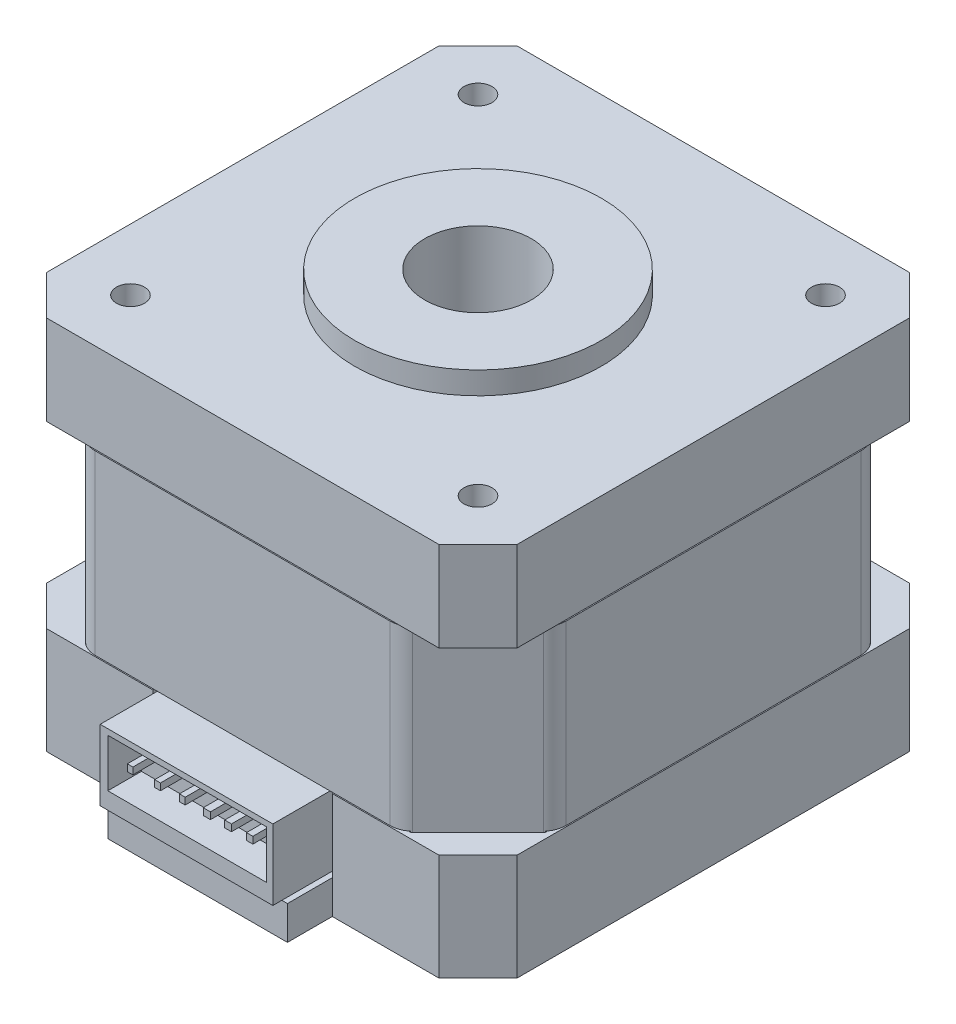
from build123d import *

# Parameters (mm, degrees)
SKETCH_1_R             = 0.5
EXTRUDE_1_DEPTH        = 8
EXTRUDE_2_DEPTH        = 16
EXTRUDE_3_DEPTH        = 9.5
SKETCH_5_W             = 57.653933414
SKETCH_5_H             = 56.367180184
SKETCH_5_W_2           = 41
SKETCH_5_H_2           = 41
CUT_EXTRUDE_1_DEPTH    = 0.1
SKETCH_6_W             = 58.986763218
SKETCH_6_H             = 56.93915862
SKETCH_6_W_2           = 41
SKETCH_6_H_2           = 41
CUT_EXTRUDE_2_DEPTH    = 0.1
SKETCH_7_R             = 3
CUT_EXTRUDE_3_DEPTH    = 3
HOLE_WIZARD_M3_1_D     = 2.5
HOLE_WIZARD_M3_1_DEPTH = 5
HOLE_WIZARD_M3_1_TIP   = 0.751075774
SKETCH_10_R            = 11
EXTRUDE_4_DEPTH        = 2
SKETCH_11_R            = 4.75
CUT_EXTRUDE_4_DEPTH    = 69
SKETCH_12_R            = 5
CUT_EXTRUDE_5_DEPTH    = 3
CUT_EXTRUDE_6_DEPTH    = 0.1
SKETCH_14_W            = 16
SKETCH_14_H            = 4
EXTRUDE_5_DEPTH        = 3
SKETCH_15_W            = 16
SKETCH_15_H            = 6.5
CUT_EXTRUDE_7_DEPTH    = 1
SKETCH_16_W            = 15.4
SKETCH_16_H            = 6.3
EXTRUDE_6_DEPTH        = 6
SKETCH_17_W            = 14.170279092
SKETCH_17_H            = 4.295136409
SKETCH_17_W_2          = 0.495592662
SKETCH_17_H_2          = 0.605724366
SKETCH_17_W_3          = 0.513947946
SKETCH_17_W_4          = 0.513947947
SKETCH_17_W_5          = 0.642434933
SKETCH_17_W_6          = 0.605724365
SKETCH_17_W_7          = 0.569013798
CUT_EXTRUDE_8_DEPTH    = 3


with BuildPart() as part:
    # 草图1 → 凸台-拉伸1 (new body)
    with BuildSketch(Plane(origin=(0, 0, 0), x_dir=(1, 0, 0), z_dir=(0, 1, 0))):
        Polygon((-21, 17.5), (-17.5, 21), (17.5, 21), (21, 17.5), (21, -17.5), (17.5, -21), (-17.5, -21), (-21, -17.5), align=None)
        with Locations(Location((-15.5, 15.5, 0), (0, 0, 270))):
            Circle(SKETCH_1_R, mode=Mode.SUBTRACT)
        with Locations(Location((15.5, 15.5, 0), (0, 0, 270))):
            Circle(SKETCH_1_R, mode=Mode.SUBTRACT)
        with Locations(Location((15.5, -15.5, 0), (0, 0, 270))):
            Circle(SKETCH_1_R, mode=Mode.SUBTRACT)
        with Locations(Location((-15.5, -15.5, 0), (0, 0, 270))):
            Circle(SKETCH_1_R, mode=Mode.SUBTRACT)
    extrude(amount=EXTRUDE_1_DEPTH)

    # 草图2 → 凸台-拉伸2 (add)
    with BuildSketch(Plane.XZ):
        with BuildLine():
            Line((-20.414213562, 14.585786438), (-14.585786438, 20.414213562))
            ThreePointArc((-14.585786438, 20.414213562), (-13.93693974, 20.847759065), (-13.171572875, 21))
            Line((-13.171572875, 21), (13.171572875, 21))
            ThreePointArc((13.171572875, 21), (13.93693974, 20.847759065), (14.585786438, 20.414213562))
            Line((14.585786438, 20.414213562), (20.414213562, 14.585786438))
            ThreePointArc((20.414213562, 14.585786438), (20.847759065, 13.93693974), (21, 13.171572875))
            Line((21, 13.171572875), (21, -13.171572875))
            ThreePointArc((21, -13.171572875), (20.847759065, -13.93693974), (20.414213562, -14.585786438))
            Line((20.414213562, -14.585786438), (14.585786438, -20.414213562))
            ThreePointArc((14.585786438, -20.414213562), (13.93693974, -20.847759065), (13.171572875, -21))
            Line((13.171572875, -21), (-13.171572875, -21))
            ThreePointArc((-13.171572875, -21), (-13.93693974, -20.847759065), (-14.585786438, -20.414213562))
            Line((-14.585786438, -20.414213562), (-20.414213562, -14.585786438))
            ThreePointArc((-20.414213562, -14.585786438), (-20.847759065, -13.93693974), (-21, -13.171572875))
            Line((-21, -13.171572875), (-21, 13.171572875))
            ThreePointArc((-21, 13.171572875), (-20.847759065, 13.93693974), (-20.414213562, 14.585786438))
        make_face()
    extrude(amount=EXTRUDE_2_DEPTH)

    # 草图3 → 凸台-拉伸3 (add)
    with BuildSketch(Plane.XZ.offset(16)):
        Polygon((-21, 17.5), (-17.5, 21), (17.5, 21), (21, 17.5), (21, -17.5), (17.5, -21), (-17.5, -21), (-21, -17.5), align=None)
    extrude(amount=EXTRUDE_3_DEPTH)

    # 草图5 → 切除-拉伸1 (cut)
    with BuildSketch(Plane.XZ):
        Rectangle(SKETCH_5_W, SKETCH_5_H)
        Rectangle(SKETCH_5_W_2, SKETCH_5_H_2, mode=Mode.SUBTRACT)
    extrude(amount=CUT_EXTRUDE_1_DEPTH, mode=Mode.SUBTRACT)

    # 草图6 → 切除-拉伸2 (cut)
    with BuildSketch(Plane(origin=(0, -16, 0), x_dir=(1, 0, 0), z_dir=(0, 1, 0))):
        Rectangle(SKETCH_6_W, SKETCH_6_H)
        Rectangle(SKETCH_6_W_2, SKETCH_6_H_2, mode=Mode.SUBTRACT)
    extrude(amount=CUT_EXTRUDE_2_DEPTH, mode=Mode.SUBTRACT)

    # 草图7 → 切除-拉伸3 (cut)
    with BuildSketch(Plane.XZ.offset(25.5)):
        with Locations(Location((-15.5, 15.5, 0), (0, 0, 270))):
            Circle(SKETCH_7_R)
        with Locations(Location((15.5, 15.5, 0), (0, 0, 270))):
            Circle(SKETCH_7_R)
        with Locations(Location((-15.5, -15.5, 0), (0, 0, 270))):
            Circle(SKETCH_7_R)
        with Locations(Location((15.5, -15.5, 0), (0, 0, 270))):
            Circle(SKETCH_7_R)
    extrude(amount=-CUT_EXTRUDE_3_DEPTH, mode=Mode.SUBTRACT)

    # M3 螺纹孔的螺纹孔钻头1
    with Locations(Plane(origin=(0, 8, 0), x_dir=(1, 0, 0), z_dir=(0, 1, 0))):
        with Locations((-15.5, 15.5), (15.5, 15.5), (-15.5, -15.5), (15.5, -15.5)):
            Hole(HOLE_WIZARD_M3_1_D / 2, depth=HOLE_WIZARD_M3_1_DEPTH)
            with Locations((0, 0, -(HOLE_WIZARD_M3_1_DEPTH + HOLE_WIZARD_M3_1_TIP / 2))):  # 118° drill point
                Cone(0, HOLE_WIZARD_M3_1_D / 2, HOLE_WIZARD_M3_1_TIP, mode=Mode.SUBTRACT)

    # 草图10 → 凸台-拉伸4 (add)
    with BuildSketch(Plane(origin=(0, 8, 0), x_dir=(1, 0, 0), z_dir=(0, 1, 0))):
        with Locations(Location((0, 0, 0), (0, 0, 90))):
            Circle(SKETCH_10_R)
    extrude(amount=EXTRUDE_4_DEPTH)

    # 草图11 → 切除-拉伸4 (cut)
    with BuildSketch(Plane(origin=(0, 10, 0), x_dir=(1, 0, 0), z_dir=(0, 1, 0))):
        with Locations(Location((0, 0, 0), (0, 0, 270))):
            Circle(SKETCH_11_R)
    extrude(amount=-CUT_EXTRUDE_4_DEPTH, mode=Mode.SUBTRACT)

    # 草图12 → 切除-拉伸5 (cut)
    with BuildSketch(Plane.XZ.offset(25.5)):
        with Locations(Location((0, 0, 0), (0, 0, 270))):
            Circle(SKETCH_12_R)
    extrude(amount=-CUT_EXTRUDE_5_DEPTH, mode=Mode.SUBTRACT)

    # 草图13 → 切除-拉伸6 (cut)
    # profile 1 of 8: a face of its own
    with BuildSketch(Plane.XZ.offset(25.5)):
        with BuildLine():
            Line((-7.893407465, 13.891280791), (-7.838218886, 13.891280791))
            Line((-7.838218886, 13.891280791), (-7.843439427, 11.217617889))
            add(Edge.make_bspline(
                [(-7.843439427, 11.217617889), (-7.844034145, 11.1935056), (-7.84517445, 11.14727297), (-7.845266995, 11.081126066), (-7.847442407, 11.021236179), (-7.847615678, 10.967517565), (-7.84923328, 10.920040401), (-7.851103879, 10.878794752), (-7.851281622, 10.843703303), (-7.854590379, 10.788780657), (-7.858533201, 10.713266114), (-7.868311197, 10.635487418), (-7.876095217, 10.580066843), (-7.884008314, 10.554838428), (-7.894033397, 10.53487688), (-7.90403841, 10.537204765), (-7.908323297, 10.538201737)],
                knots=[0, 0, 0, 0, 1.45038606, 2.780953852, 3.977268029, 5.053718292, 6.010937745, 6.833690271, 7.536464333, 8.120251454, 10.142880859, 12.069479857, 12.873132744, 13.440417135, 13.76034519, 14, 14, 14, 14], degree=3))
            add(Edge.make_bspline(
                [(-7.908323297, 10.538201737), (-7.909313826, 10.5389515), (-7.913553533, 10.542160668), (-7.92366406, 10.548953295), (-7.935677452, 10.567161334), (-7.940936163, 10.583496392), (-7.944121294, 10.593390316)],
                knots=[0, 0, 0, 0, 0.221265066, 0.947068446, 2.150880552, 4, 4, 4, 4], degree=3))
            Line((-7.944121294, 10.593390316), (-7.968732417, 10.659019977))
            Line((-7.968732417, 10.659019977), (-8.024666787, 10.840247337))
            add(Edge.make_bspline(
                [(-8.024666787, 10.840247337), (-8.031400079, 10.857298964), (-8.043129126, 10.887002019), (-8.054961145, 10.926080513), (-8.063937314, 10.951033782), (-8.066323107, 10.971259492), (-8.05483073, 10.990231261), (-8.046366988, 11.019442001), (-8.033343551, 11.056727589), (-8.021044965, 11.100734686), (-8.010182413, 11.148283659), (-8.000397149, 11.19965883), (-7.994851558, 11.257541563), (-7.99213123, 11.312807422), (-7.99004354, 11.366016856), (-7.989664239, 11.41724272), (-7.988618076, 11.477895709), (-7.988781507, 11.521651593), (-7.98886879, 11.545020403)],
                knots=[0, 0, 0, 0, 1.220359697, 2.125803599, 2.712350858, 2.994193817, 3.439826662, 4.12562012, 5.031064022, 6.063176816, 7.167225426, 8.277459231, 9.542238136, 11.034069985, 11.961482632, 13.08703073, 14.444263491, 16, 16, 16, 16], degree=3))
            Line((-7.98886879, 11.545020403), (-7.984394041, 13.518384989))
            Line((-7.984394041, 13.518384989), (-8.246166894, 13.291664341))
            Line((-8.246166894, 13.291664341), (-8.266303267, 13.377430376))
            add(Edge.make_bspline(
                [(-8.266303267, 13.377430376), (-8.245024828, 13.399417495), (-8.205137517, 13.440633256), (-8.151830389, 13.499976546), (-8.10798714, 13.551477121), (-8.062321472, 13.611683706), (-8.011193546, 13.686610427), (-7.973437187, 13.748168407), (-7.953816585, 13.780157842)],
                knots=[0, 0, 0, 0, 1.077185482, 2.019228619, 2.808185376, 3.45765616, 4.678836699, 6, 6, 6, 6], degree=3))
            Line((-7.953816585, 13.780157842), (-7.893407465, 13.891280791))
        make_face()
    # profile 2 of 8: a face of its own
    with BuildSketch(Plane.XZ.offset(25.5)):
        with BuildLine():
            add(Edge.make_bspline(
                [(-5.586674032, 13.593709941), (-5.622222861, 13.594235683), (-5.690335163, 13.595243014), (-5.787539006, 13.596231812), (-5.875297591, 13.595492561), (-5.953107037, 13.597273068), (-6.021219903, 13.59561878), (-6.079643364, 13.596152064), (-6.1283835, 13.595520536), (-6.157703617, 13.594263904), (-6.170628858, 13.593709941)],
                knots=[0, 0, 0, 0, 1.461051911, 2.799406174, 3.994695385, 5.067439477, 5.997164994, 6.794024468, 7.468367567, 8, 8, 8, 8], degree=3))
            Line((-6.170628858, 13.593709941), (-6.412265338, 13.58401465))
            add(Edge.make_bspline(
                [(-6.412265338, 13.58401465), (-6.430031076, 13.584155265), (-6.460595666, 13.584397182), (-6.490136123, 13.576768191), (-6.502506122, 13.573573568)],
                knots=[0, 0, 0, 0, 1.16250452, 2, 2, 2, 2], degree=3))
            Line((-6.502506122, 13.573573568), (-6.553219952, 13.553437194))
            add(Edge.make_bspline(
                [(-6.553219952, 13.553437194), (-6.558948955, 13.552190365), (-6.568941751, 13.550015587), (-6.578831705, 13.552413876), (-6.583051616, 13.553437194)],
                knots=[0, 0, 0, 0, 1.146626707, 2, 2, 2, 2], degree=3))
            add(Edge.make_bspline(
                [(-6.583051616, 13.553437194), (-6.58715783, 13.555496577), (-6.597750757, 13.560809228), (-6.612740593, 13.577372046), (-6.633028109, 13.599865979), (-6.646413539, 13.618874117), (-6.653901818, 13.629507938)],
                knots=[0, 0, 0, 0, 0.522008364, 1.346640983, 2.515617707, 4, 4, 4, 4], degree=3))
            Line((-6.653901818, 13.629507938), (-6.759058434, 13.750326178))
            add(Edge.make_bspline(
                [(-6.759058434, 13.750326178), (-6.763048951, 13.755761193), (-6.769156806, 13.764079988), (-6.776618082, 13.776860012), (-6.770212103, 13.787019988), (-6.763389042, 13.789209339), (-6.759058434, 13.790598925)],
                knots=[0, 0, 0, 0, 1.576958087, 2.413680609, 2.993160347, 4, 4, 4, 4], degree=3))
            Line((-6.759058434, 13.790598925), (-6.658376568, 13.780157842))
            Line((-6.658376568, 13.780157842), (-6.482369749, 13.770462551))
            add(Edge.make_bspline(
                [(-6.482369749, 13.770462551), (-6.440866976, 13.767495821), (-6.362137123, 13.761867999), (-6.249977765, 13.757428952), (-6.150458244, 13.756085554), (-6.088338309, 13.758773762), (-6.059505909, 13.760021469)],
                knots=[0, 0, 0, 0, 1.17952993, 2.237542501, 3.181971475, 4, 4, 4, 4], degree=3))
            Line((-6.059505909, 13.760021469), (-5.611285155, 13.770462551))
            Line((-5.611285155, 13.770462551), (-5.506128539, 13.921112455))
            Line((-5.506128539, 13.921112455), (-5.329375929, 13.664560143))
            Line((-5.329375929, 13.664560143), (-5.450194169, 13.553437194))
            add(Edge.make_bspline(
                [(-5.450194169, 13.553437194), (-5.455577734, 13.540225485), (-5.465457592, 13.515979505), (-5.480275417, 13.483044017), (-5.490897568, 13.455607369), (-5.499605154, 13.435575885), (-5.506895827, 13.418955583), (-5.514338348, 13.401795432), (-5.5242749, 13.378921827), (-5.536579468, 13.350165893), (-5.552620804, 13.316250205), (-5.569505954, 13.276135376), (-5.589785731, 13.23070404), (-5.619979927, 13.163855756), (-5.65692412, 13.079594492), (-5.696667338, 12.981710261), (-5.733688931, 12.891852313), (-5.776175172, 12.779295846), (-5.824367457, 12.636602931), (-5.880745852, 12.456185153), (-5.935646103, 12.258519085), (-5.991765797, 12.045195479), (-6.041711409, 11.818606867), (-6.077200102, 11.625316454), (-6.099846572, 11.471336457), (-6.114409223, 11.360504082), (-6.124368645, 11.254475037), (-6.132956538, 11.15432057), (-6.137951451, 11.060790911), (-6.141039044, 10.975013514), (-6.142070222, 10.897414581), (-6.14069886, 10.848449335), (-6.140051403, 10.825331505)],
                knots=[0, 0, 0, 0, 0.452499367, 0.830421745, 1.145244612, 1.385457386, 1.523169464, 1.720933553, 1.978750205, 2.31422616, 2.712964021, 3.168544679, 3.694564508, 4.291044716, 5.495236599, 6.612541028, 7.641936826, 8.577774526, 10.428066285, 12.41833758, 14.572718391, 16.934712686, 19.414194725, 21.930665941, 23.166281125, 24.350715242, 25.475866727, 26.54391973, 27.539008514, 28.446374518, 29.266490973, 30, 30, 30, 30], degree=3))
            Line((-6.140051403, 10.825331505), (-6.140051403, 10.60905194))
            Line((-6.140051403, 10.60905194), (-6.175103608, 10.588915566))
            Line((-6.175103608, 10.588915566), (-6.336194595, 10.946149745))
            add(Edge.make_bspline(
                [(-6.336194595, 10.946149745), (-6.333107303, 10.955815573), (-6.32767087, 10.972836193), (-6.321860765, 10.995326811), (-6.317914656, 11.010705317), (-6.3165305, 11.018734956), (-6.316058221, 11.021474697)],
                knots=[0, 0, 0, 0, 1.560097851, 2.74718673, 3.572535822, 4, 4, 4, 4], degree=3))
            Line((-6.316058221, 11.021474697), (-6.275785475, 11.16242931))
            add(Edge.make_bspline(
                [(-6.275785475, 11.16242931), (-6.270540529, 11.192256634), (-6.259357152, 11.255855045), (-6.2420786, 11.357224482), (-6.224348486, 11.470903752), (-6.205924341, 11.59204326), (-6.187018258, 11.711328028), (-6.170426454, 11.819105915), (-6.154391413, 11.910238705), (-6.140472132, 11.990481697), (-6.123530403, 12.070871613), (-6.100908993, 12.162017556), (-6.072320927, 12.269602524), (-6.039389619, 12.389620246), (-6.002074481, 12.513702359), (-5.965492123, 12.634669796), (-5.927207409, 12.747073346), (-5.901247772, 12.819116561), (-5.888719632, 12.853884669)],
                knots=[0, 0, 0, 0, 0.835904569, 1.782332284, 2.838215692, 4.011468279, 5.164379694, 6.171749793, 7.021175418, 7.718362152, 8.4194883, 9.288205322, 10.310099412, 11.492047838, 12.723030323, 13.886349048, 14.979950486, 16, 16, 16, 16], degree=3))
            Line((-5.888719632, 12.853884669), (-5.707492272, 13.302105424))
            Line((-5.707492272, 13.302105424), (-5.586674032, 13.593709941))
        make_face()
    # profile 3 of 8: a face of its own
    with BuildSketch(Plane.XZ.offset(25.5)):
        with BuildLine():
            Line((-4.714097855, 12.330338963), (-3.813181597, 12.436241371))
            Line((-3.813181597, 12.436241371), (-3.813181597, 13.327462338))
            add(Edge.make_bspline(
                [(-3.813181597, 13.327462338), (-3.813529154, 13.359038728), (-3.814292858, 13.428423086), (-3.818043858, 13.517128496), (-3.819926436, 13.591046776), (-3.824296057, 13.640943423), (-3.827213533, 13.683121036), (-3.834709532, 13.72856031), (-3.844044823, 13.78040281), (-3.853289845, 13.820463893), (-3.857929093, 13.840566962)],
                knots=[0, 0, 0, 0, 1.46744149, 3.224481516, 4.126299343, 4.90251787, 5.552072189, 6.089638665, 7.041360766, 8, 8, 8, 8], degree=3))
            Line((-3.857929093, 13.840566962), (-3.878065466, 13.921112455))
            Line((-3.878065466, 13.921112455), (-3.83331797, 13.971826284))
            Line((-3.83331797, 13.971826284), (-3.616292613, 13.669780685))
            add(Edge.make_bspline(
                [(-3.616292613, 13.669780685), (-3.622178324, 13.652936173), (-3.632659219, 13.622940555), (-3.645781085, 13.577786487), (-3.653806865, 13.527894162), (-3.661902642, 13.478517504), (-3.667653581, 13.427743279), (-3.670381947, 13.379453519), (-3.671660842, 13.323243364), (-3.672029883, 13.283212667), (-3.672226983, 13.261832677)],
                knots=[0, 0, 0, 0, 1.034161492, 1.841568026, 2.720364137, 3.95915506, 4.741893149, 5.680086666, 6.760957793, 8, 8, 8, 8], degree=3))
            Line((-3.672226983, 13.261832677), (-3.672226983, 11.228058971))
            Line((-3.672226983, 11.228058971), (-3.692363357, 10.689597433))
            add(Edge.make_bspline(
                [(-3.692363357, 10.689597433), (-3.693121116, 10.677171101), (-3.694500781, 10.654546276), (-3.69622092, 10.623627), (-3.699823032, 10.599152585), (-3.701732626, 10.576189014), (-3.707122537, 10.557253171), (-3.711355611, 10.541723811), (-3.722342888, 10.535396211), (-3.725648403, 10.54062625), (-3.727415562, 10.543422279)],
                knots=[0, 0, 0, 0, 1.782056354, 3.244618926, 4.42725805, 5.323067691, 6.531120047, 7.247096294, 7.597490544, 8, 8, 8, 8], degree=3))
            add(Edge.make_bspline(
                [(-3.727415562, 10.543422279), (-3.730909572, 10.547006344), (-3.74286747, 10.559272447), (-3.745610441, 10.576629861), (-3.747551935, 10.588915566)],
                knots=[0, 0, 0, 0, 0.584385278, 2, 2, 2, 2], degree=3))
            Line((-3.747551935, 10.588915566), (-3.7773836, 10.649324686))
            Line((-3.7773836, 10.649324686), (-3.83779272, 10.825331505))
            add(Edge.make_bspline(
                [(-3.83779272, 10.825331505), (-3.844488503, 10.841170422), (-3.856120027, 10.868684867), (-3.868441764, 10.905098195), (-3.877379791, 10.929995782), (-3.876477785, 10.951991641), (-3.864868684, 10.973091098), (-3.854775156, 11.004077099), (-3.842200849, 11.043323431), (-3.833107007, 11.089961566), (-3.824302027, 11.137896079), (-3.818225635, 11.183707362), (-3.814412731, 11.225504232), (-3.813074715, 11.257383386), (-3.813212815, 11.28374489), (-3.813167294, 11.308852995), (-3.813187445, 11.344402489), (-3.813179424, 11.390392934), (-3.813182354, 11.44707311), (-3.813181344, 11.514194349), (-3.813181674, 11.591756678), (-3.813181623, 11.646945256), (-3.813181597, 11.676279726)],
                knots=[0, 0, 0, 0, 1.190143081, 2.067447299, 2.673393139, 3.001188833, 3.557860616, 4.310020916, 5.263836027, 6.409373277, 7.599017452, 8.641879088, 9.610516428, 10.507063897, 10.85163508, 11.437406092, 12.247148373, 13.315319042, 14.624689539, 16.175259864, 17.967030018, 20, 20, 20, 20], degree=3))
            Line((-3.813181597, 11.676279726), (-3.813181597, 12.24979347))
            Line((-3.813181597, 12.24979347), (-4.719318396, 12.139416312))
            Line((-4.719318396, 12.139416312), (-4.714097855, 11.052052153))
            add(Edge.make_bspline(
                [(-4.714097855, 11.052052153), (-4.714327389, 11.023454967), (-4.714840756, 10.959495826), (-4.72185775, 10.860620736), (-4.727052899, 10.76251393), (-4.731904208, 10.677710034), (-4.734578075, 10.612503347), (-4.743186183, 10.562485266), (-4.750520895, 10.534656116), (-4.762566867, 10.51071817), (-4.779688224, 10.524175294), (-4.782372394, 10.535620067), (-4.784202266, 10.543422279)],
                knots=[0, 0, 0, 0, 1.480742141, 3.311759243, 5.1299228, 6.573886411, 7.696591102, 8.545303974, 9.099038742, 9.382560764, 9.579074942, 10, 10, 10, 10], degree=3))
            Line((-4.784202266, 10.543422279), (-4.820000263, 10.649324686))
            Line((-4.820000263, 10.649324686), (-4.880409383, 10.835026796))
            add(Edge.make_bspline(
                [(-4.880409383, 10.835026796), (-4.884721219, 10.846683647), (-4.892388774, 10.867412528), (-4.901544355, 10.895444209), (-4.907490947, 10.916520015), (-4.90878303, 10.938426844), (-4.901684462, 10.965721455), (-4.892116624, 11.005773121), (-4.878595447, 11.058891544), (-4.867545164, 11.122738858), (-4.856746827, 11.18798802), (-4.853406138, 11.236474923), (-4.851946197, 11.269320144), (-4.851032801, 11.292935563), (-4.851641393, 11.323526115), (-4.850163748, 11.360803319), (-4.850930849, 11.404816349), (-4.849476964, 11.455520862), (-4.849939396, 11.513200785), (-4.849869177, 11.553970188), (-4.849831927, 11.575597859)],
                knots=[0, 0, 0, 0, 0.89440678, 1.590485457, 2.124353431, 2.464834642, 3.156297362, 4.132862491, 5.439341602, 7.095985926, 8.796698138, 10.196654753, 10.590757748, 11.163686739, 11.89739384, 12.792337533, 13.848159947, 15.065171594, 16.443109321, 18, 18, 18, 18], degree=3))
            Line((-4.849831927, 11.575597859), (-4.849831927, 13.317021256))
            add(Edge.make_bspline(
                [(-4.849831927, 13.317021256), (-4.850060356, 13.348601518), (-4.850558935, 13.417529683), (-4.856106493, 13.505489091), (-4.860835709, 13.578555194), (-4.864218579, 13.629080086), (-4.869126776, 13.672749613), (-4.873579424, 13.720837211), (-4.880022499, 13.771177694), (-4.886980243, 13.808770002), (-4.890104674, 13.82565113)],
                knots=[0, 0, 0, 0, 1.483614415, 3.238187741, 4.139484673, 4.924258038, 5.616965174, 6.203905796, 7.193449433, 8, 8, 8, 8], degree=3))
            Line((-4.890104674, 13.82565113), (-4.915461588, 13.911417165))
            Line((-4.915461588, 13.911417165), (-4.8699683, 13.956164661))
            Line((-4.8699683, 13.956164661), (-4.648468194, 13.659339602))
            add(Edge.make_bspline(
                [(-4.648468194, 13.659339602), (-4.65457, 13.642733231), (-4.665607462, 13.612694224), (-4.680034525, 13.567327361), (-4.691358081, 13.515660495), (-4.702328931, 13.451783604), (-4.712722238, 13.376481162), (-4.713637492, 13.323522543), (-4.714097855, 13.296884882)],
                knots=[0, 0, 0, 0, 0.859882532, 1.555428207, 2.311609949, 3.427964232, 4.7062915, 6, 6, 6, 6], degree=3))
            Line((-4.714097855, 13.296884882), (-4.714097855, 12.330338963))
        make_face()
    # profile 4 of 8: a face of its own
    with BuildSketch(Plane.XZ.offset(25.5)):
        with BuildLine():
            Line((-2.160507401, 13.558657736), (-2.109793572, 13.865923877))
            Line((-2.109793572, 13.865923877), (-2.059825534, 13.860703335))
            Line((-2.059825534, 13.860703335), (-2.059825534, 12.602552899))
            Line((-2.059825534, 12.602552899), (-2.120234654, 12.597332357))
            Line((-2.120234654, 12.597332357), (-2.15528686, 13.130573355))
            add(Edge.make_bspline(
                [(-2.15528686, 13.130573355), (-2.159901979, 13.160225548), (-2.168433171, 13.215038557), (-2.185156119, 13.289267687), (-2.200666686, 13.350011983), (-2.22470107, 13.41157089), (-2.260366765, 13.477293025), (-2.312902168, 13.547736816), (-2.375935224, 13.611192285), (-2.450685039, 13.661108648), (-2.531703097, 13.699258951), (-2.589951709, 13.706509424), (-2.618423446, 13.710053431)],
                knots=[0, 0, 0, 0, 1.116474761, 2.063838624, 2.831507158, 3.446633667, 4.518832044, 5.603216916, 6.708904972, 7.82779241, 8.938231816, 10, 10, 10, 10], degree=3))
            add(Edge.make_bspline(
                [(-2.618423446, 13.710053431), (-2.635386721, 13.709326321), (-2.670214312, 13.707833478), (-2.713932463, 13.697551509), (-2.751190888, 13.683915073), (-2.782003762, 13.66637139), (-2.815895315, 13.64287488), (-2.851299518, 13.613706145), (-2.886898942, 13.580376214), (-2.918472267, 13.541641782), (-2.946189441, 13.499225903), (-2.975911077, 13.438085806), (-3.005507277, 13.360159066), (-3.025072414, 13.279447688), (-3.033624361, 13.211977542), (-3.038877383, 13.155014015), (-3.042250619, 13.091079834), (-3.045210041, 13.021948963), (-3.042666653, 12.950727307), (-3.032404197, 12.881078936), (-3.013927827, 12.814813198), (-2.995327117, 12.773633416), (-2.986098707, 12.753202803)],
                knots=[0, 0, 0, 0, 0.864038106, 1.773971445, 2.275285977, 2.88209936, 3.574564674, 4.376127188, 5.218616224, 6.055847121, 6.916999662, 7.795414815, 9.515900782, 11.157236165, 12.013901558, 12.981067707, 14.072720019, 15.277182195, 16.507433409, 17.699229733, 18.858513907, 20, 20, 20, 20], degree=3))
            add(Edge.make_bspline(
                [(-2.986098707, 12.753202803), (-2.975650244, 12.734257174), (-2.955274141, 12.6973103), (-2.91716602, 12.648121054), (-2.872411675, 12.608254372), (-2.809549088, 12.567637045), (-2.734144047, 12.531335808), (-2.674707532, 12.507333015), (-2.64825511, 12.496650491)],
                knots=[0, 0, 0, 0, 0.892298636, 1.740118821, 2.553971753, 3.353728668, 4.822268012, 6, 6, 6, 6], degree=3))
            Line((-2.64825511, 12.496650491), (-2.472248292, 12.425800288))
            add(Edge.make_bspline(
                [(-2.472248292, 12.425800288), (-2.450533482, 12.415785795), (-2.408722997, 12.396503525), (-2.349794974, 12.36582815), (-2.29644364, 12.335494273), (-2.235057832, 12.294408774), (-2.167417998, 12.24044765), (-2.100582386, 12.166027578), (-2.046272132, 12.081688541), (-2.012205367, 11.983350418), (-1.985373973, 11.876670011), (-1.967257137, 11.760776994), (-1.955295785, 11.634251333), (-1.950488041, 11.498884765), (-1.952617275, 11.359000052), (-1.9704987, 11.267683048), (-1.979280041, 11.22283843)],
                knots=[0, 0, 0, 0, 0.703245545, 1.354054533, 1.953549274, 2.507188807, 3.525842386, 4.488918984, 5.43838142, 6.454223102, 7.53246407, 8.673253088, 9.899948524, 11.268249991, 12.658472344, 14, 14, 14, 14], degree=3))
            add(Edge.make_bspline(
                [(-1.979280041, 11.22283843), (-1.990259458, 11.177865043), (-2.011525921, 11.090754319), (-2.057536466, 10.990670678), (-2.097867666, 10.919897896), (-2.127745946, 10.874032092), (-2.157622349, 10.834616644), (-2.19666871, 10.78836007), (-2.256889177, 10.739599157), (-2.327148211, 10.700770481), (-2.391821362, 10.676629921), (-2.445502407, 10.66282861), (-2.503138879, 10.655833175), (-2.542834201, 10.654489825), (-2.563234867, 10.653799436)],
                knots=[0, 0, 0, 0, 1.868422262, 3.619020558, 4.429541533, 5.162879566, 5.830420081, 6.429075538, 7.606854402, 8.938752151, 9.657684361, 10.394048182, 11.174651193, 12, 12, 12, 12], degree=3))
            add(Edge.make_bspline(
                [(-2.563234867, 10.653799436), (-2.58614382, 10.65394517), (-2.630983718, 10.654230417), (-2.696587483, 10.664841262), (-2.758495519, 10.684261839), (-2.816145512, 10.713137711), (-2.870063029, 10.749203732), (-2.920138401, 10.79198618), (-2.966450384, 10.841033591), (-3.010182464, 10.895397188), (-3.048488271, 10.956783293), (-3.083101405, 11.023546595), (-3.112707071, 11.096030451), (-3.145899605, 11.198329461), (-3.17506694, 11.328285445), (-3.183409609, 11.433499009), (-3.18746244, 11.484611283)],
                knots=[0, 0, 0, 0, 0.833862414, 1.63212638, 2.411403016, 3.189256699, 3.973153178, 4.770028097, 5.583768076, 6.428386665, 7.307987397, 8.215552436, 9.166047206, 10.157242313, 12.13320567, 14, 14, 14, 14], degree=3))
            Line((-3.18746244, 11.484611283), (-3.207598814, 11.751604678))
            Line((-3.207598814, 11.751604678), (-3.136748611, 11.751604678))
            add(Edge.make_bspline(
                [(-3.136748611, 11.751604678), (-3.132673088, 11.720011484), (-3.124832357, 11.65923065), (-3.111055599, 11.571553419), (-3.097776543, 11.490731966), (-3.08080213, 11.394143012), (-3.054247365, 11.285035152), (-3.012413102, 11.166461257), (-2.957783913, 11.062403052), (-2.899418844, 10.989305274), (-2.849226776, 10.938450107), (-2.80921294, 10.909253119), (-2.770234469, 10.884031026), (-2.717407388, 10.86245849), (-2.651584822, 10.845221837), (-2.598644095, 10.845387442), (-2.572930158, 10.845467878)],
                knots=[0, 0, 0, 0, 1.134650933, 2.182907786, 3.161205505, 4.052250561, 5.675932663, 7.155002512, 8.52184542, 9.839854562, 10.472309825, 11.060302883, 11.600982628, 12.120735338, 13.087218943, 14, 14, 14, 14], degree=3))
            add(Edge.make_bspline(
                [(-2.572930158, 10.845467878), (-2.550233235, 10.846279156), (-2.506694495, 10.847835402), (-2.444431689, 10.861050605), (-2.387713978, 10.881302743), (-2.337739374, 10.912387291), (-2.292921584, 10.949907818), (-2.252481555, 10.993791763), (-2.215418256, 11.043219679), (-2.184511011, 11.098710112), (-2.157225046, 11.156069767), (-2.134798895, 11.213080125), (-2.118163594, 11.26874387), (-2.1068854, 11.323691855), (-2.099235926, 11.380514015), (-2.095337711, 11.441048991), (-2.092494804, 11.50672602), (-2.094060583, 11.551980318), (-2.09487774, 11.575597859)],
                knots=[0, 0, 0, 0, 1.108065456, 2.12556444, 3.098260599, 4.035950869, 4.98490885, 5.94776606, 6.946521194, 7.996930623, 9.045863326, 10.049925535, 10.987930625, 11.881525266, 12.788809675, 13.787786499, 14.845478855, 16, 16, 16, 16], degree=3))
            add(Edge.make_bspline(
                [(-2.09487774, 11.575597859), (-2.097488716, 11.612459524), (-2.102361906, 11.681259028), (-2.118164523, 11.77595051), (-2.137454874, 11.855487307), (-2.163196258, 11.920863459), (-2.194469609, 11.974913761), (-2.22733693, 12.02349612), (-2.264382102, 12.066816407), (-2.306591149, 12.104553614), (-2.352963166, 12.139536547), (-2.405175757, 12.172068117), (-2.463656154, 12.202970656), (-2.505655239, 12.220543461), (-2.52743687, 12.229657096)],
                knots=[0, 0, 0, 0, 1.578487453, 2.946127177, 4.097996722, 5.070650713, 5.936469873, 6.761635482, 7.575228913, 8.364955199, 9.176673428, 10.055112166, 10.991339211, 12, 12, 12, 12], degree=3))
            Line((-2.52743687, 12.229657096), (-2.744462227, 12.31020259))
            add(Edge.make_bspline(
                [(-2.744462227, 12.31020259), (-2.778233205, 12.324965125), (-2.845153316, 12.354218365), (-2.936493596, 12.413382691), (-3.016084358, 12.48500417), (-3.080176672, 12.571942306), (-3.1293943, 12.673165489), (-3.15946336, 12.767998526), (-3.176211498, 12.853198831), (-3.183663054, 12.925821981), (-3.188558286, 13.005711879), (-3.187839352, 13.061206653), (-3.18746244, 13.090300608)],
                knots=[0, 0, 0, 0, 1.141640751, 2.262259852, 3.359181592, 4.444772656, 5.58953336, 6.835542724, 7.519006772, 8.279340868, 9.097919025, 10, 10, 10, 10], degree=3))
            add(Edge.make_bspline(
                [(-3.18746244, 13.090300608), (-3.187249898, 13.115418052), (-3.186839036, 13.163972261), (-3.181617172, 13.234214517), (-3.172744401, 13.298952232), (-3.156846385, 13.377985773), (-3.128397721, 13.470800195), (-3.084205349, 13.574704449), (-3.032994621, 13.667513301), (-2.974121684, 13.745340278), (-2.906907293, 13.806190077), (-2.845713026, 13.848315004), (-2.790123084, 13.873334026), (-2.742455647, 13.886861586), (-2.689473853, 13.89374956), (-2.652498327, 13.895070888), (-2.633339278, 13.895755541)],
                knots=[0, 0, 0, 0, 0.971164436, 1.877345498, 2.721647718, 3.496542433, 4.992871533, 6.466013358, 7.856401207, 9.083219229, 10.219456221, 11.349985082, 11.939558551, 12.569451447, 13.258754286, 14, 14, 14, 14], degree=3))
            add(Edge.make_bspline(
                [(-2.633339278, 13.895755541), (-2.611865088, 13.893312692), (-2.56915585, 13.888454198), (-2.50651161, 13.871476013), (-2.445910529, 13.847098245), (-2.389314565, 13.814005014), (-2.33726385, 13.77715652), (-2.29042942, 13.738909455), (-2.252150715, 13.697526821), (-2.231085478, 13.668251382), (-2.220916521, 13.654119061)],
                knots=[0, 0, 0, 0, 1.049956055, 2.088219507, 3.145806661, 4.218152357, 5.268178035, 6.24663062, 7.15358473, 8, 8, 8, 8], degree=3))
            Line((-2.220916521, 13.654119061), (-2.160507401, 13.558657736))
        make_face()
    # profile 5 of 8: a face of its own
    with BuildSketch(Plane.XZ.offset(25.5)):
        with BuildLine():
            add(Edge.make_bspline(
                [(-0.924730712, 12.667436768), (-0.913559078, 12.690563813), (-0.892038386, 12.73511504), (-0.860648437, 12.799467983), (-0.831364475, 12.858552059), (-0.806317852, 12.913378517), (-0.782963013, 12.962738621), (-0.762162505, 13.007160787), (-0.744189465, 13.046659541), (-0.72526765, 13.090511615), (-0.705642838, 13.136259504), (-0.686644372, 13.181068392), (-0.672828464, 13.213076414), (-0.66568561, 13.23000933), (-0.662957859, 13.236475762)],
                knots=[0, 0, 0, 0, 1.475873638, 2.843077615, 4.114458223, 5.26483622, 6.306479236, 7.252326145, 8.083448402, 8.799989154, 9.996708352, 10.943956596, 11.596712522, 12, 12, 12, 12], degree=3))
            Line((-0.662957859, 13.236475762), (-0.501866873, 13.664560143))
            add(Edge.make_bspline(
                [(-0.501866873, 13.664560143), (-0.536903029, 13.661131453), (-0.613350196, 13.653650218), (-0.710910253, 13.647710102), (-0.792027945, 13.643384282), (-0.84768855, 13.638720159), (-0.896428358, 13.634360737), (-0.926475348, 13.631044112), (-0.940392336, 13.629507938)],
                knots=[0, 0, 0, 0, 1.440114021, 3.142257811, 3.998086789, 4.76330671, 5.427195687, 6, 6, 6, 6], degree=3))
            Line((-0.940392336, 13.629507938), (-1.09104224, 13.604151023))
            add(Edge.make_bspline(
                [(-1.09104224, 13.604151023), (-1.097773685, 13.602735848), (-1.116138906, 13.598874863), (-1.15010187, 13.588331707), (-1.19901481, 13.575366058), (-1.236244226, 13.564703525), (-1.257353768, 13.558657736)],
                knots=[0, 0, 0, 0, 0.478461291, 1.305373098, 2.472113022, 4, 4, 4, 4], degree=3))
            Line((-1.257353768, 13.558657736), (-1.307321805, 13.538521362))
            Line((-1.307321805, 13.538521362), (-1.433360587, 13.724969263))
            add(Edge.make_bspline(
                [(-1.433360587, 13.724969263), (-1.438682784, 13.732269092), (-1.447768344, 13.744730678), (-1.455310977, 13.762065998), (-1.460909775, 13.774109264), (-1.455891739, 13.786236848), (-1.43604895, 13.784418296), (-1.421067343, 13.773781597), (-1.401931643, 13.763547727), (-1.379915591, 13.762108396), (-1.353224341, 13.760541986), (-1.333661992, 13.763582354), (-1.322983429, 13.76524201)],
                knots=[0, 0, 0, 0, 1.323589942, 2.259509366, 2.829398404, 3.190947808, 3.965341466, 5.19662492, 6.050472624, 7.088782, 8.410843841, 10, 10, 10, 10], degree=3))
            Line((-1.322983429, 13.76524201), (-1.161892443, 13.770462551))
            Line((-1.161892443, 13.770462551), (-0.527223787, 13.845787503))
            Line((-0.527223787, 13.845787503), (-0.47725575, 13.891280791))
            Line((-0.47725575, 13.891280791), (-0.436983003, 13.931553538))
            add(Edge.make_bspline(
                [(-0.436983003, 13.931553538), (-0.435734027, 13.930066805), (-0.430613919, 13.923972026), (-0.419591242, 13.909469196), (-0.39999138, 13.886168456), (-0.385173012, 13.866750863), (-0.376573883, 13.855482794)],
                knots=[0, 0, 0, 0, 0.23984028, 0.983211964, 2.249351781, 4, 4, 4, 4], degree=3))
            Line((-0.376573883, 13.855482794), (-0.280366766, 13.734664554))
            add(Edge.make_bspline(
                [(-0.280366766, 13.734664554), (-0.273906306, 13.726276512), (-0.263170046, 13.712336915), (-0.25520502, 13.690043486), (-0.263366735, 13.674939174), (-0.274768158, 13.661992038), (-0.293249927, 13.646441536), (-0.307893129, 13.635620507), (-0.316164763, 13.629507938)],
                knots=[0, 0, 0, 0, 1.419029252, 2.358201718, 2.827787952, 3.596253847, 4.642174893, 6, 6, 6, 6], degree=3))
            Line((-0.316164763, 13.629507938), (-0.371353342, 13.58401465))
            add(Edge.make_bspline(
                [(-0.371353342, 13.58401465), (-0.387481876, 13.543481352), (-0.418083506, 13.466575111), (-0.462174391, 13.357124245), (-0.502519352, 13.259806691), (-0.537945023, 13.173772538), (-0.570484, 13.099999645), (-0.597346849, 13.037401543), (-0.621532155, 12.987180168), (-0.636325155, 12.957781597), (-0.642821486, 12.944871245)],
                knots=[0, 0, 0, 0, 1.507300768, 2.859891598, 4.076963614, 5.147345159, 6.074452096, 6.862861548, 7.500626815, 8, 8, 8, 8], degree=3))
            Line((-0.642821486, 12.944871245), (-0.794217182, 12.657741477))
            add(Edge.make_bspline(
                [(-0.794217182, 12.657741477), (-0.776321723, 12.659170324), (-0.742048763, 12.661906816), (-0.689743993, 12.667130647), (-0.63275494, 12.659945314), (-0.582770611, 12.639954706), (-0.540242672, 12.615287828), (-0.506165026, 12.590650465), (-0.473608975, 12.558628788), (-0.44041181, 12.520984967), (-0.407137098, 12.476055113), (-0.376549165, 12.421635835), (-0.344707518, 12.359493885), (-0.30488587, 12.26479055), (-0.261856883, 12.138075555), (-0.23571317, 11.978920814), (-0.222796175, 11.819464131), (-0.220899867, 11.713345447), (-0.219957646, 11.660618102)],
                knots=[0, 0, 0, 0, 0.660541429, 1.265053373, 1.928435853, 2.750244091, 3.225390118, 3.735570922, 4.291687282, 4.900607759, 5.580848831, 6.342918567, 7.193367346, 8.147740655, 10.119512469, 12.097611575, 14.061014616, 16, 16, 16, 16], degree=3))
            add(Edge.make_bspline(
                [(-0.219957646, 11.660618102), (-0.221948008, 11.619338223), (-0.225729057, 11.540919706), (-0.234866957, 11.430108325), (-0.24850337, 11.332892398), (-0.268362472, 11.22328987), (-0.303385451, 11.102200646), (-0.346651899, 10.990484652), (-0.387732738, 10.909999638), (-0.422354753, 10.85663052), (-0.460275736, 10.808885024), (-0.501026777, 10.767102539), (-0.543416268, 10.732766105), (-0.584557207, 10.703235646), (-0.626187661, 10.682364477), (-0.680082011, 10.66492868), (-0.745942194, 10.652910077), (-0.798396997, 10.650502203), (-0.824048846, 10.649324686)],
                knots=[0, 0, 0, 0, 1.512752116, 2.8737433, 4.067977017, 5.104892351, 6.948544146, 8.672095895, 9.482011449, 10.251829035, 10.996496654, 11.710742831, 12.38300564, 12.991319199, 13.561044299, 14.079002633, 15.060579187, 16, 16, 16, 16], degree=3))
            add(Edge.make_bspline(
                [(-0.824048846, 10.649324686), (-0.845928781, 10.648951733), (-0.888023266, 10.648234214), (-0.949080212, 10.653204715), (-1.004689666, 10.664581284), (-1.056842099, 10.680057363), (-1.105684543, 10.704530991), (-1.152338523, 10.739491477), (-1.199304123, 10.782541292), (-1.244334733, 10.835371283), (-1.285547361, 10.895896956), (-1.321582597, 10.96284662), (-1.351522917, 11.035272462), (-1.381287372, 11.138344394), (-1.406515272, 11.270143071), (-1.41100969, 11.376846829), (-1.413224213, 11.429422705)],
                knots=[0, 0, 0, 0, 0.828828519, 1.594571005, 2.314948186, 2.97625877, 3.650192192, 4.371738268, 5.178272596, 6.059897072, 6.995131469, 7.947518938, 8.935744196, 9.957858231, 12.008325587, 14, 14, 14, 14], degree=3))
            Line((-1.413224213, 11.429422705), (-1.418444754, 11.625565897))
            Line((-1.418444754, 11.625565897), (-1.363256176, 11.625565897))
            add(Edge.make_bspline(
                [(-1.363256176, 11.625565897), (-1.359035978, 11.596479422), (-1.350953926, 11.540776243), (-1.339197651, 11.460410712), (-1.327021339, 11.387152085), (-1.313298976, 11.300457499), (-1.290444819, 11.203108827), (-1.251942534, 11.098336246), (-1.199728042, 11.009810024), (-1.1384218, 10.936858343), (-1.066720497, 10.88390625), (-0.989963065, 10.850505169), (-0.911733386, 10.834734613), (-0.859901161, 10.834930675), (-0.834489928, 10.835026796)],
                knots=[0, 0, 0, 0, 0.994021113, 1.903638599, 2.746793397, 3.505624798, 4.871908371, 6.122639036, 7.264652637, 8.331625701, 9.323760524, 10.250011688, 11.142051883, 12, 12, 12, 12], degree=3))
            add(Edge.make_bspline(
                [(-0.834489928, 10.835026796), (-0.814046973, 10.836789646), (-0.774007729, 10.840242335), (-0.715946479, 10.853387088), (-0.662251502, 10.875816085), (-0.612057369, 10.904497887), (-0.566877643, 10.941899945), (-0.526215646, 10.985971782), (-0.491780135, 11.038328068), (-0.453187628, 11.118482516), (-0.415681635, 11.228986011), (-0.387461353, 11.36934479), (-0.369097954, 11.51251447), (-0.360470929, 11.6549676), (-0.359295452, 11.795308667), (-0.370835339, 11.887157526), (-0.376573883, 11.932832038)],
                knots=[0, 0, 0, 0, 0.647840119, 1.268849254, 1.871153999, 2.479976942, 3.088343857, 3.716462885, 4.367721208, 5.059616847, 6.52246665, 8.039623249, 9.575767262, 11.078710543, 12.547304005, 14, 14, 14, 14], degree=3))
            add(Edge.make_bspline(
                [(-0.376573883, 11.932832038), (-0.384598065, 11.98206243), (-0.400460025, 12.079379585), (-0.437151802, 12.196188688), (-0.473282968, 12.283412761), (-0.505518242, 12.341933172), (-0.542055517, 12.394205745), (-0.583442953, 12.438047524), (-0.625398204, 12.474024534), (-0.667510087, 12.498031096), (-0.709097791, 12.510384355), (-0.735746243, 12.507668425), (-0.748723894, 12.506345782)],
                knots=[0, 0, 0, 0, 2.019199264, 3.991492233, 4.943861116, 5.841091039, 6.693606335, 7.520378909, 8.278781735, 8.923571305, 9.475785111, 10, 10, 10, 10], degree=3))
            Line((-0.748723894, 12.506345782), (-0.829269387, 12.496650491))
            Line((-0.829269387, 12.496650491), (-0.864321592, 12.43102083))
            add(Edge.make_bspline(
                [(-0.864321592, 12.43102083), (-0.869000118, 12.422841739), (-0.877155936, 12.408583577), (-0.888300775, 12.389737499), (-0.897202018, 12.378698916), (-0.903958264, 12.369182848), (-0.91372498, 12.372384066), (-0.920006948, 12.383323035), (-0.930049253, 12.399426733), (-0.936581679, 12.413257458), (-0.940392336, 12.421325539)],
                knots=[0, 0, 0, 0, 1.659028505, 2.892093886, 3.763458346, 4.288089223, 4.647361994, 5.327919393, 6.441255868, 8, 8, 8, 8], degree=3))
            Line((-0.940392336, 12.421325539), (-1.020937829, 12.577195984))
            add(Edge.make_bspline(
                [(-1.020937829, 12.577195984), (-1.026759814, 12.586154411), (-1.036909194, 12.601771504), (-1.032509163, 12.619573695), (-1.03063312, 12.627164022)],
                knots=[0, 0, 0, 0, 1.147259222, 2, 2, 2, 2], degree=3))
            Line((-1.03063312, 12.627164022), (-0.990360374, 12.642825645))
            Line((-0.990360374, 12.642825645), (-0.924730712, 12.667436768))
        make_face()
    # profile 6 of 8: a face of its own
    with BuildSketch(Plane.XZ.offset(25.5)):
        with BuildLine():
            Line((1.180638987, 11.630786438), (0.47064538, 11.590513691))
            Line((0.47064538, 11.590513691), (0.420677342, 11.515188739))
            add(Edge.make_bspline(
                [(0.420677342, 11.515188739), (0.417416645, 11.50729524), (0.412488721, 11.495365717), (0.394268932, 11.483062917), (0.38060047, 11.500710235), (0.374141547, 11.512218942), (0.369963513, 11.519663489)],
                knots=[0, 0, 0, 0, 1.282902353, 1.938863145, 2.666728425, 4, 4, 4, 4], degree=3))
            Line((0.369963513, 11.519663489), (0.274502188, 11.711331931))
            add(Edge.make_bspline(
                [(0.274502188, 11.711331931), (0.270418398, 11.722650283), (0.263684272, 11.741314128), (0.258781578, 11.766365547), (0.260175543, 11.784033893), (0.263410995, 11.793160421), (0.264806897, 11.797097966)],
                knots=[0, 0, 0, 0, 1.63130738, 2.690008936, 3.434818089, 4, 4, 4, 4], degree=3))
            Line((0.264806897, 11.797097966), (0.305079644, 11.806793257))
            Line((0.305079644, 11.806793257), (0.360268222, 11.837370712))
            Line((0.360268222, 11.837370712), (1.211216443, 13.891280791))
            Line((1.211216443, 13.891280791), (1.321593601, 13.891280791))
            Line((1.321593601, 13.891280791), (1.321593601, 11.817234339))
            add(Edge.make_bspline(
                [(1.321593601, 11.817234339), (1.331965146, 11.817155707), (1.349600719, 11.817022002), (1.36568314, 11.824039251), (1.37230743, 11.82692963)],
                knots=[0, 0, 0, 0, 1.176207474, 2, 2, 2, 2], degree=3))
            Line((1.37230743, 11.82692963), (1.447632382, 11.857507086))
            add(Edge.make_bspline(
                [(1.447632382, 11.857507086), (1.457370026, 11.861141427), (1.474727069, 11.867619524), (1.497076507, 11.877348442), (1.512897768, 11.884839267), (1.520269723, 11.890496735), (1.522957334, 11.892559291)],
                knots=[0, 0, 0, 0, 1.495147538, 2.665053038, 3.513315187, 4, 4, 4, 4], degree=3))
            Line((1.522957334, 11.892559291), (1.558009539, 11.922390955))
            Line((1.558009539, 11.922390955), (1.698964152, 11.776961592))
            add(Edge.make_bspline(
                [(1.698964152, 11.776961592), (1.706144899, 11.768320067), (1.71789949, 11.754174243), (1.723029871, 11.730235269), (1.718137298, 11.714046056), (1.708991265, 11.702387527), (1.693048793, 11.697500576), (1.681313913, 11.696819876), (1.674353029, 11.696416099)],
                knots=[0, 0, 0, 0, 1.690587597, 2.767423091, 3.557953073, 4.202677464, 4.933866242, 6, 6, 6, 6], degree=3))
            Line((1.674353029, 11.696416099), (1.321593601, 11.656143352))
            Line((1.321593601, 11.656143352), (1.321593601, 10.754481303))
            add(Edge.make_bspline(
                [(1.321593601, 10.754481303), (1.321575647, 10.751746382), (1.321515229, 10.742542324), (1.322673665, 10.723166607), (1.323143405, 10.69233655), (1.323747879, 10.654026329), (1.324783103, 10.615584921), (1.324448635, 10.584449411), (1.322430475, 10.564815043), (1.317683798, 10.552196705), (1.308392329, 10.549937304), (1.303623194, 10.552124311), (1.301457227, 10.553117569)],
                knots=[0, 0, 0, 0, 0.375701713, 1.264380521, 2.665139726, 4.612257271, 6.525225464, 7.960129458, 8.858599367, 9.286556546, 9.675980055, 10, 10, 10, 10], degree=3))
            add(Edge.make_bspline(
                [(1.301457227, 10.553117569), (1.297246371, 10.555620447), (1.284552594, 10.563165462), (1.273427434, 10.587514044), (1.26005983, 10.612786436), (1.254050458, 10.63108467), (1.25148919, 10.638883604)],
                knots=[0, 0, 0, 0, 0.572299195, 1.725216547, 3.030459198, 4, 4, 4, 4], degree=3))
            Line((1.25148919, 10.638883604), (1.205995902, 10.72987018))
            Line((1.205995902, 10.72987018), (1.180638987, 10.79997459))
            add(Edge.make_bspline(
                [(1.180638987, 10.79997459), (1.176782919, 10.80837557), (1.169805288, 10.823577308), (1.162161723, 10.844531883), (1.155337198, 10.860001954), (1.151538164, 10.878406622), (1.155994545, 10.907157988), (1.165816151, 10.947421642), (1.177611381, 10.990464534), (1.183153223, 11.029796116), (1.185428315, 11.063703125), (1.185713732, 11.085609476), (1.185859528, 11.096799649)],
                knots=[0, 0, 0, 0, 0.908031708, 1.643101311, 2.192199313, 2.565975908, 3.473020803, 5.002279505, 6.661670863, 7.846934984, 8.900174221, 10, 10, 10, 10], degree=3))
            Line((1.185859528, 11.096799649), (1.180638987, 11.630786438))
        make_face()
        Polygon((1.185859528, 11.797097966), (1.185859528, 13.468416951), (0.475865921, 11.761299969), align=None, mode=Mode.SUBTRACT)
    # profile 7 of 8: a face of its own
    with BuildSketch(Plane.XZ.offset(25.5)):
        with BuildLine():
            add(Edge.make_bspline(
                [(2.183728695, 12.320643672), (2.186159087, 12.36889066), (2.191138503, 12.467739699), (2.204674987, 12.619251924), (2.224641743, 12.777314317), (2.247795567, 12.939641293), (2.279834222, 13.099997642), (2.320837701, 13.252495199), (2.373181917, 13.393492365), (2.425413256, 13.50176013), (2.469567256, 13.581140713), (2.501693506, 13.633946587), (2.53225716, 13.681568489), (2.562369372, 13.72294311), (2.591924606, 13.758174563), (2.619182032, 13.78872322), (2.646690824, 13.812506818), (2.681190832, 13.836090436), (2.723184777, 13.857124523), (2.771847903, 13.87552552), (2.818672471, 13.886169912), (2.849176369, 13.886095935), (2.863890639, 13.88606025)],
                knots=[0, 0, 0, 0, 1.583211401, 3.243703523, 4.983978234, 6.804605119, 8.6166428, 10.340282122, 11.974804003, 13.53820457, 14.274983449, 14.951299633, 15.563740824, 16.129235462, 16.626851747, 17.070813204, 17.469389546, 17.815167281, 18.438300608, 19.002855301, 19.519003895, 20, 20, 20, 20], degree=3))
            add(Edge.make_bspline(
                [(2.863890639, 13.88606025), (2.877960825, 13.883599916), (2.907679249, 13.878403308), (2.951615205, 13.859081309), (2.998246895, 13.833385217), (3.047860572, 13.800080802), (3.097395108, 13.755301212), (3.143301801, 13.695991939), (3.185920442, 13.623558593), (3.238883044, 13.508921652), (3.297246039, 13.353539078), (3.343072373, 13.190389609), (3.372839732, 13.054167393), (3.392252812, 12.945484077), (3.407689319, 12.830236397), (3.424265678, 12.668220568), (3.439048744, 12.460612994), (3.441431322, 12.293326402), (3.442624924, 12.209520723)],
                knots=[0, 0, 0, 0, 0.36369769, 0.768186139, 1.217229854, 1.724510149, 2.290946358, 2.914777825, 3.632489608, 4.433551378, 6.137860108, 7.866765886, 8.757390638, 9.699141408, 10.686159515, 11.726895222, 13.859299765, 16, 16, 16, 16], degree=3))
            add(Edge.make_bspline(
                [(3.442624924, 12.209520723), (3.438059381, 12.142368151), (3.428676239, 12.004355607), (3.406354283, 11.792983844), (3.369539262, 11.573091837), (3.323212225, 11.387864536), (3.278402454, 11.240383977), (3.240402218, 11.133963387), (3.197884148, 11.033464374), (3.152504151, 10.939860892), (3.105294796, 10.856536669), (3.056425984, 10.786520191), (3.004786454, 10.732593418), (2.951733612, 10.693857784), (2.899934324, 10.667607212), (2.850440358, 10.650822962), (2.803307076, 10.641506458), (2.772684033, 10.643261778), (2.757988231, 10.644104145)],
                knots=[0, 0, 0, 0, 1.760488992, 3.618172134, 5.557361062, 7.587083219, 8.607294374, 9.588398617, 10.541277716, 11.460251193, 12.307925722, 13.044175775, 13.687957546, 14.251129358, 14.754223989, 15.200440537, 15.616296545, 16, 16, 16, 16], degree=3))
            add(Edge.make_bspline(
                [(2.757988231, 10.644104145), (2.743945983, 10.646078), (2.71436005, 10.650236761), (2.669763668, 10.667737314), (2.623322441, 10.694700954), (2.573743236, 10.730244571), (2.523819716, 10.779076176), (2.475746309, 10.84223649), (2.429644555, 10.920068709), (2.38583262, 11.011088041), (2.344682528, 11.112468082), (2.308650435, 11.221858712), (2.275267416, 11.336810062), (2.248518627, 11.45699774), (2.226507205, 11.578466753), (2.209236634, 11.697865283), (2.197118565, 11.813796518), (2.190578759, 11.92579807), (2.18829196, 12.033013771), (2.185875139, 12.134437301), (2.184363202, 12.229653109), (2.18393499, 12.291060206), (2.183728695, 12.320643672)],
                knots=[0, 0, 0, 0, 0.451175502, 0.950591959, 1.515271951, 2.162531354, 2.891688268, 3.734081857, 4.687580886, 5.773002708, 6.954198864, 8.17563603, 9.445923076, 10.771603705, 12.101713585, 13.383756751, 14.619631726, 15.819374781, 16.961914306, 18.040825747, 19.056148764, 20, 20, 20, 20], degree=3))
        make_face()
        with BuildLine():
            add(Edge.make_bspline(
                [(2.314988018, 12.31020259), (2.314457273, 12.286089773), (2.313330226, 12.234885728), (2.312258368, 12.153332647), (2.314257991, 12.06258606), (2.317674688, 11.928675509), (2.330218704, 11.753671224), (2.362278922, 11.543570507), (2.408067046, 11.340104655), (2.458521423, 11.180665372), (2.50549406, 11.067007155), (2.541538852, 10.996466769), (2.579459276, 10.939479757), (2.619188393, 10.896072287), (2.659375384, 10.865310105), (2.696931611, 10.843328105), (2.732520808, 10.828233637), (2.756372125, 10.826265084), (2.767683522, 10.825331505)],
                knots=[0, 0, 0, 0, 0.705717407, 1.498604912, 2.386138873, 3.361274458, 5.418191474, 7.514713171, 9.57394393, 11.515405308, 12.398906158, 13.169972934, 13.829695216, 14.395845116, 14.883250105, 15.303691084, 15.669778158, 16, 16, 16, 16], degree=3))
            add(Edge.make_bspline(
                [(2.767683522, 10.825331505), (2.778155334, 10.825466192), (2.800648648, 10.825755499), (2.835840491, 10.834218531), (2.872837465, 10.852033495), (2.913875416, 10.875443915), (2.956034664, 10.911473181), (2.997646594, 10.960711279), (3.03843256, 11.023815585), (3.07910893, 11.098434422), (3.117585824, 11.181452233), (3.152053025, 11.269406661), (3.182048726, 11.360200186), (3.214489333, 11.487226469), (3.24783984, 11.651974652), (3.277796218, 11.853159096), (3.297662283, 12.051555705), (3.305935453, 12.213409395), (3.308236734, 12.341525873), (3.306324235, 12.443475675), (3.302715875, 12.552878569), (3.298584268, 12.628413434), (3.296449769, 12.667436768)],
                knots=[0, 0, 0, 0, 0.308126263, 0.661851094, 1.055455993, 1.515432549, 2.051181639, 2.679899785, 3.409545513, 4.262246801, 5.183512362, 6.104777924, 7.045624675, 8.000099589, 9.967578284, 11.997814557, 13.993544283, 15.842664909, 16.77344086, 17.770161498, 18.848005724, 20, 20, 20, 20], degree=3))
            add(Edge.make_bspline(
                [(3.296449769, 12.667436768), (3.292852948, 12.703993691), (3.28587157, 12.774950151), (3.273597783, 12.877498886), (3.258367338, 12.972673723), (3.236906527, 13.089927129), (3.202263148, 13.230619447), (3.154544343, 13.364562783), (3.113387429, 13.465691272), (3.078011888, 13.529765717), (3.04203217, 13.584142514), (3.002049654, 13.625638864), (2.963131231, 13.657975445), (2.926501729, 13.682143904), (2.892289647, 13.699207993), (2.869251447, 13.703062521), (2.858670097, 13.70483289)],
                knots=[0, 0, 0, 0, 1.302834758, 2.528783491, 3.662347304, 4.720685654, 6.75648594, 8.792057095, 9.759925264, 10.624039914, 11.384659521, 12.06448684, 12.659424566, 13.175428451, 13.621277708, 14, 14, 14, 14], degree=3))
            add(Edge.make_bspline(
                [(2.858670097, 13.70483289), (2.847167627, 13.703995869), (2.822996845, 13.702236989), (2.786097953, 13.690926822), (2.746934335, 13.673241455), (2.703907694, 13.648709785), (2.659086245, 13.609336757), (2.613828552, 13.551702781), (2.566998619, 13.475255135), (2.518120705, 13.38114816), (2.471419145, 13.2702715), (2.431740111, 13.143272255), (2.397452197, 13.002298912), (2.371625698, 12.851326063), (2.35076306, 12.700226753), (2.334496044, 12.558201522), (2.322033959, 12.429676874), (2.317246804, 12.348503638), (2.314988018, 12.31020259)],
                knots=[0, 0, 0, 0, 0.347392606, 0.729995465, 1.156884588, 1.644891073, 2.219813456, 2.945627096, 3.849684979, 4.924243867, 6.145708801, 7.477723151, 8.938118981, 10.524254447, 12.100980159, 13.544449593, 14.841364989, 16, 16, 16, 16], degree=3))
        make_face(mode=Mode.SUBTRACT)
    # profile 8 of 8: a face of its own
    with BuildSketch(Plane.XZ.offset(25.5)):
        with BuildLine():
            Line((4.61202616, 13.891280791), (4.667214738, 13.891280791))
            Line((4.667214738, 13.891280791), (4.661994197, 11.217617889))
            add(Edge.make_bspline(
                [(4.661994197, 11.217617889), (4.66139948, 11.1935056), (4.660259175, 11.14727297), (4.66016663, 11.081126066), (4.657991218, 11.021236179), (4.657817947, 10.967517565), (4.656200345, 10.920040401), (4.654329745, 10.878794752), (4.654152002, 10.843703303), (4.650843245, 10.788780657), (4.646900423, 10.713266114), (4.637122428, 10.635487418), (4.629338408, 10.580066843), (4.62142531, 10.554838428), (4.611400228, 10.53487688), (4.601395215, 10.537204765), (4.597110328, 10.538201737)],
                knots=[0, 0, 0, 0, 1.45038606, 2.780953852, 3.977268029, 5.053718292, 6.010937745, 6.833690271, 7.536464333, 8.120251454, 10.142880859, 12.069479857, 12.873132744, 13.440417135, 13.76034519, 14, 14, 14, 14], degree=3))
            add(Edge.make_bspline(
                [(4.597110328, 10.538201737), (4.596119798, 10.5389515), (4.591880091, 10.542160668), (4.581769564, 10.548953295), (4.569756173, 10.567161334), (4.564497461, 10.583496392), (4.561312331, 10.593390316)],
                knots=[0, 0, 0, 0, 0.221265066, 0.947068446, 2.150880552, 4, 4, 4, 4], degree=3))
            Line((4.561312331, 10.593390316), (4.536701208, 10.659019977))
            Line((4.536701208, 10.659019977), (4.480766837, 10.840247337))
            add(Edge.make_bspline(
                [(4.480766837, 10.840247337), (4.474033545, 10.857298964), (4.462304499, 10.887002019), (4.45047248, 10.926080513), (4.441496311, 10.951033782), (4.439110517, 10.971259492), (4.450602895, 10.990231261), (4.459066636, 11.019442001), (4.472090074, 11.056727589), (4.484388659, 11.100734686), (4.495251211, 11.148283659), (4.505036476, 11.19965883), (4.510582066, 11.257541563), (4.513302394, 11.312807422), (4.515390084, 11.366016856), (4.515769385, 11.41724272), (4.516815549, 11.477895709), (4.516652118, 11.521651593), (4.516564834, 11.545020403)],
                knots=[0, 0, 0, 0, 1.220359697, 2.125803599, 2.712350858, 2.994193817, 3.439826662, 4.12562012, 5.031064022, 6.063176816, 7.167225426, 8.277459231, 9.542238136, 11.034069985, 11.961482632, 13.08703073, 14.444263491, 16, 16, 16, 16], degree=3))
            Line((4.516564834, 11.545020403), (4.521039584, 13.518384989))
            Line((4.521039584, 13.518384989), (4.259266731, 13.291664341))
            Line((4.259266731, 13.291664341), (4.239130357, 13.377430376))
            add(Edge.make_bspline(
                [(4.239130357, 13.377430376), (4.260408796, 13.399417495), (4.300296107, 13.440633256), (4.353603236, 13.499976546), (4.397446484, 13.551477121), (4.443112153, 13.611683706), (4.494240078, 13.686610427), (4.531996438, 13.748168407), (4.55161704, 13.780157842)],
                knots=[0, 0, 0, 0, 1.077185482, 2.019228619, 2.808185376, 3.45765616, 4.678836699, 6, 6, 6, 6], degree=3))
            Line((4.55161704, 13.780157842), (4.61202616, 13.891280791))
        make_face()
    extrude(amount=-CUT_EXTRUDE_6_DEPTH, mode=Mode.SUBTRACT)

    # 草图14 → 凸台-拉伸5 (add)
    with BuildSketch(Plane.XZ.offset(25.5)):
        with Locations((0, 23)):
            Rectangle(SKETCH_14_W, SKETCH_14_H)
    extrude(amount=-EXTRUDE_5_DEPTH)

    # 草图15 → 切除-拉伸7 (cut)
    with BuildSketch(Plane.XY.offset(21)):
        with Locations((0, -19.25)):
            Rectangle(SKETCH_15_W, SKETCH_15_H)
    extrude(amount=-CUT_EXTRUDE_7_DEPTH, mode=Mode.SUBTRACT)

    # 草图16 → 凸台-拉伸6 (add)
    with BuildSketch(Plane.XY.offset(20)):
        with Locations((0, -19.15)):
            Rectangle(SKETCH_16_W, SKETCH_16_H)
    extrude(amount=EXTRUDE_6_DEPTH)

    # 草图17 → 切除-拉伸8 (cut)
    with BuildSketch(Plane.XY.offset(26)):
        with Locations((0.060582861, -18.65265525)):
            Rectangle(SKETCH_17_W, SKETCH_17_H)
        with Locations((-5.033008393, -18.147884945)):
            Rectangle(SKETCH_17_W_2, SKETCH_17_H_2, mode=Mode.SUBTRACT)
        with Locations((-2.582578006, -18.147884945)):
            Rectangle(SKETCH_17_W_3, SKETCH_17_H_2, mode=Mode.SUBTRACT)
        with Locations((-0.379943951, -18.147884945)):
            Rectangle(SKETCH_17_W_4, SKETCH_17_H_2, mode=Mode.SUBTRACT)
        with Locations((1.813512464, -18.147884945)):
            Rectangle(SKETCH_17_W_5, SKETCH_17_H_2, mode=Mode.SUBTRACT)
        with Locations((3.704106695, -18.147884945)):
            Rectangle(SKETCH_17_W_6, SKETCH_17_H_2, mode=Mode.SUBTRACT)
        with Locations((5.631411493, -18.147884945)):
            Rectangle(SKETCH_17_W_7, SKETCH_17_H_2, mode=Mode.SUBTRACT)
    extrude(amount=-CUT_EXTRUDE_8_DEPTH, mode=Mode.SUBTRACT)


solid = part.part
